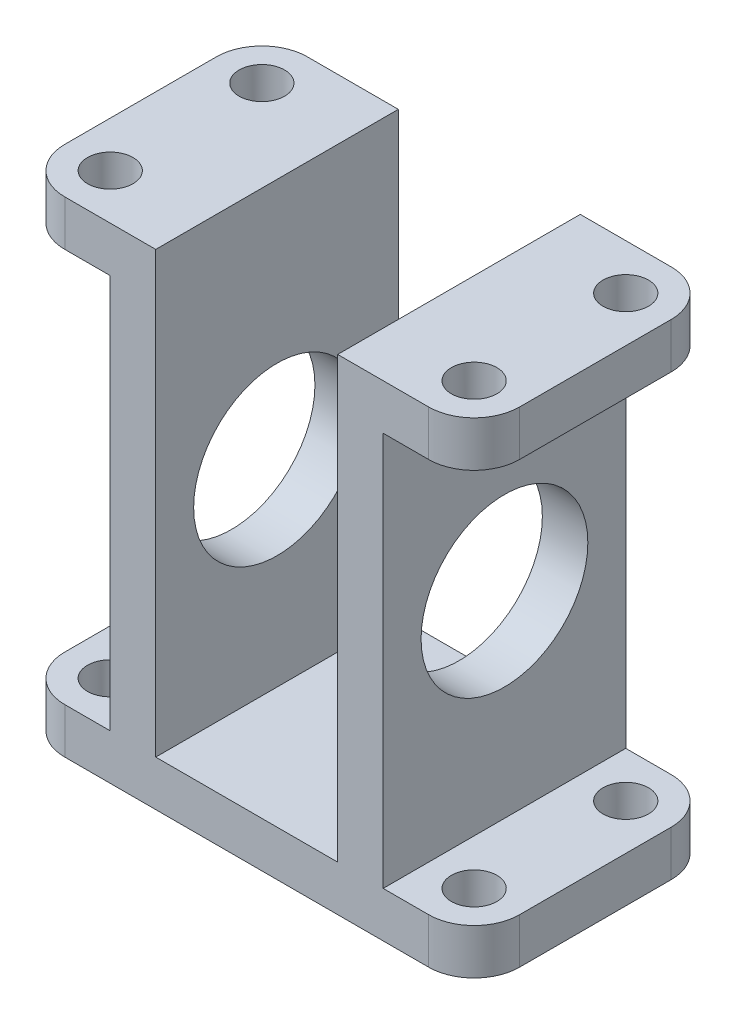
from build123d import *

# Parameters (mm, degrees)
SKETCH_1_W          = 30
SKETCH_1_H          = 16
EXTRUDE_1_DEPTH     = 3
SKETCH_2_W          = 3
SKETCH_2_H          = 16
EXTRUDE_2_DEPTH     = 29
SKETCH_4_W          = 16
SKETCH_4_H          = 3
EXTRUDE_3_DEPTH     = 6
SKETCH_5_W          = 16
SKETCH_5_H          = 3
EXTRUDE_4_DEPTH     = 6
SKETCH_6_R          = 5.5
CUT_EXTRUDE_1_DEPTH = 41.792156109
SKETCH_7_R          = 1.5
CUT_EXTRUDE_2_DEPTH = 37.235341864
FILLET_1_R          = 3


with BuildPart() as part:
    # 草图1 → 凸台-拉伸1 (new body)
    with BuildSketch(Plane(origin=(0, 0, 0), x_dir=(1, 0, 0), z_dir=(0, 1, 0))):
        Rectangle(SKETCH_1_W, SKETCH_1_H)
    extrude(amount=EXTRUDE_1_DEPTH)

    # 草图2 → 凸台-拉伸2 (add)
    with BuildSketch(Plane(origin=(0, 3, 0), x_dir=(1, 0, 0), z_dir=(0, 1, 0))):
        with Locations((7.5, 0)):
            Rectangle(SKETCH_2_W, SKETCH_2_H)
        with Locations((-7.5, 0)):
            Rectangle(SKETCH_2_W, SKETCH_2_H)
    extrude(amount=EXTRUDE_2_DEPTH)

    # 草图4 → 凸台-拉伸3 (add)
    with BuildSketch(Plane.ZY.offset(9)):
        with Locations((0, 30.5)):
            Rectangle(SKETCH_4_W, SKETCH_4_H)
    extrude(amount=EXTRUDE_3_DEPTH)

    # 草图5 → 凸台-拉伸4 (add)
    with BuildSketch(Plane(origin=(9, 0, 0), x_dir=(0, 0, -1), z_dir=(1, 0, 0))):
        with Locations((0, 30.5)):
            Rectangle(SKETCH_5_W, SKETCH_5_H)
    extrude(amount=EXTRUDE_4_DEPTH)

    # 草图6 → 切除-拉伸1 (cut, through all)
    with BuildSketch(Plane(origin=(9, 0, 0), x_dir=(0, 0, -1), z_dir=(1, 0, 0))):
        with Locations((0, 16)):
            Circle(SKETCH_6_R)
    extrude(amount=-CUT_EXTRUDE_1_DEPTH, mode=Mode.SUBTRACT)

    # 草图7 → 切除-拉伸2 (cut, through all)
    with BuildSketch(Plane(origin=(0, 32, 0), x_dir=(1, 0, 0), z_dir=(0, 1, 0))):
        with Locations(Location((12, 5, 0), (0, 0, 270))):
            Circle(SKETCH_7_R)
        with Locations(Location((12, -5, 0), (0, 0, 270))):
            Circle(SKETCH_7_R)
        with Locations(Location((-12, -5, 0), (0, 0, 270))):
            Circle(SKETCH_7_R)
        with Locations(Location((-12, 5, 0), (0, 0, 270))):
            Circle(SKETCH_7_R)
    extrude(amount=-CUT_EXTRUDE_2_DEPTH, mode=Mode.SUBTRACT)

    # 圆角1
    fillet_1_edges = [part.edges().sort_by_distance(p)[0] for p in [
        (-15, 30.5, -8),
        (-15, 30.5, 8),
        (15, 30.5, 8),
        (15, 30.5, -8),
        (15, 1.5, 8),
        (-15, 1.5, 8),
        (-15, 1.5, -8),
        (15, 1.5, -8),
    ]]
    fillet(fillet_1_edges, radius=FILLET_1_R)


solid = part.part
